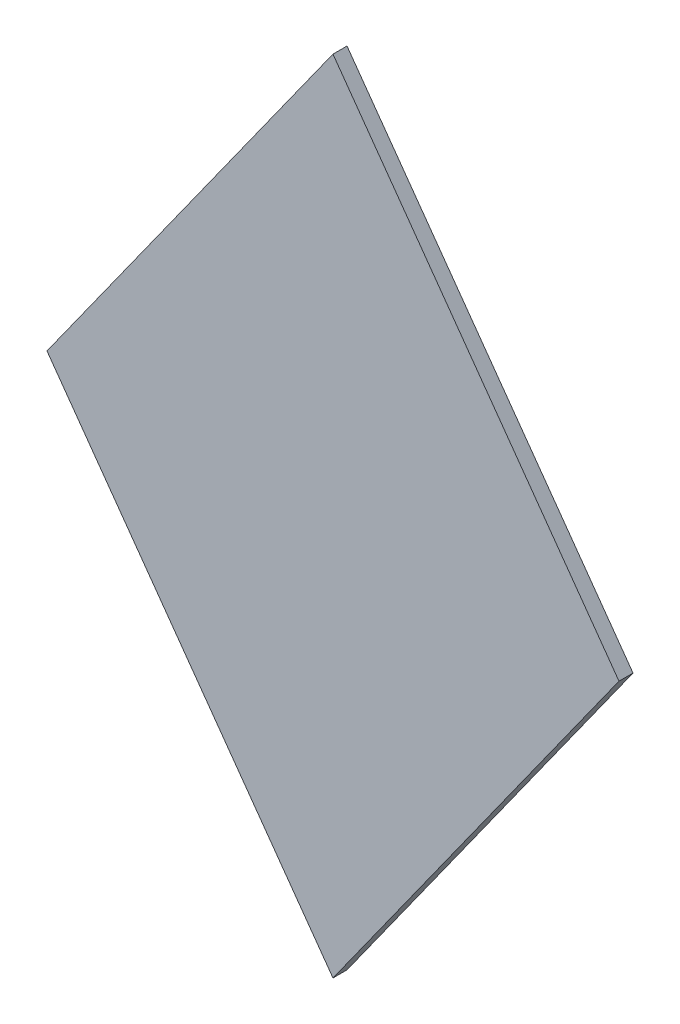
from build123d import *

# Parameters (mm, degrees)
BOSS_EXTRUDE1_DEPTH = 2


with BuildPart() as part:
    # Sketch1 → Boss-Extrude1 (new body)
    with BuildSketch(Plane.XY):
        Polygon((0, 57), (-40.75, 0), (0, -57), (40.75, 0), align=None)
    extrude(amount=BOSS_EXTRUDE1_DEPTH)


solid = part.part
